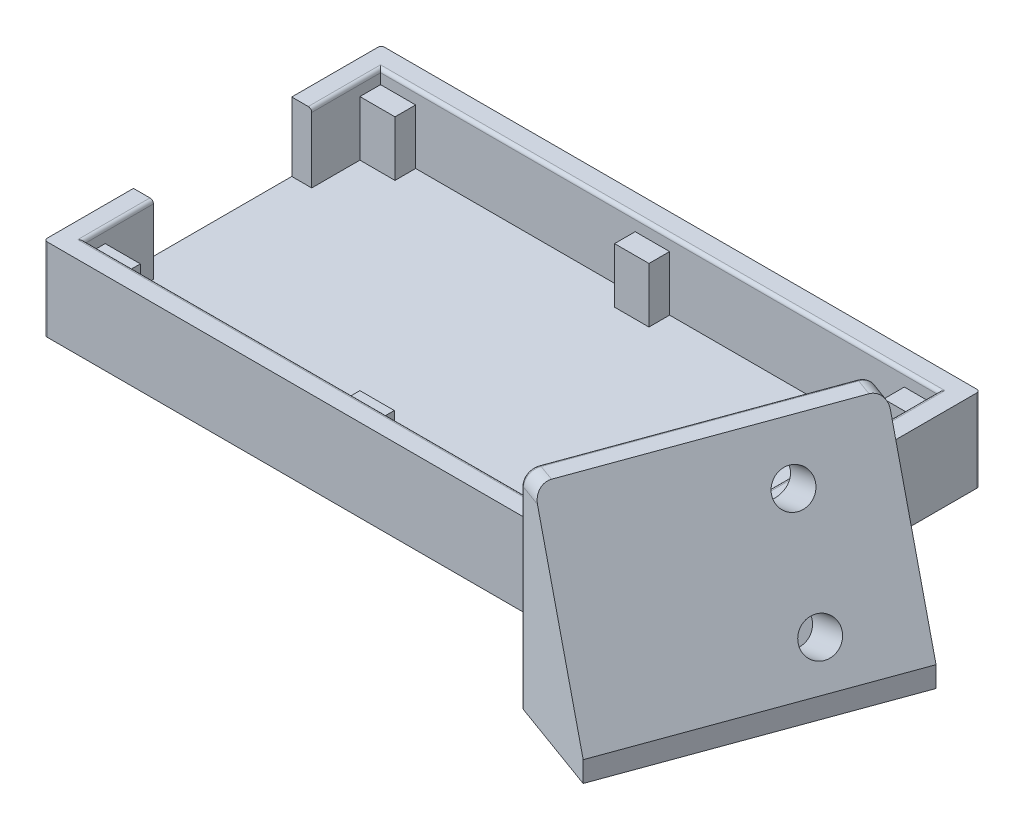
from build123d import *

# Parameters (mm, degrees)
BOSS_EXTRUDE1_DEPTH   = 40
BODY_MOVE_COPY1_ANGLE = 20
BOSS_EXTRUDE2_DEPTH   = 2
BOSS_EXTRUDE3_DEPTH   = 12
SKETCH4_R             = 2.5
CUT_EXTRUDE2_DEPTH    = 8
FILLET1_R             = 2
SKETCH10_W            = 4.9
SKETCH10_H            = 3
SKETCH10_W_2          = 5.1
SKETCH10_W_3          = 5
CUT_EXTRUDE4_DEPTH    = 2
FILLET2_R             = 0.5


with BuildPart() as part:
    # Sketch2 → Boss-Extrude1 (new body)
    with BuildSketch(Plane.XY):
        Polygon((90, 0), (105, 0), (105, 3), (93, 30), (90, 30), align=None)
    extrude(amount=BOSS_EXTRUDE1_DEPTH)


with BuildPart() as part_1:
    # Body-Move/Copy1: moved
    add(part.part.rotate(Axis((95, 0, 20), (0, -1, 0)), BODY_MOVE_COPY1_ANGLE))


with BuildPart() as part_2:
    # Body-Move/Copy2: moved
    add(part_1.part.moved(Location((-2, 0, -25))))

    # Sketch1 → Boss-Extrude2 (add)
    with BuildSketch(Plane(origin=(0, 0, 0), x_dir=(1, 0, 0), z_dir=(0, 1, 0))):
        Polygon((0, 49), (0, 0), (77, 0), (89.02081528, -12.02081528), (99.02081528, -2.02081528), (87, 10), (87, 49), align=None)
    extrude(amount=BOSS_EXTRUDE2_DEPTH)

    # Sketch1<4> → Boss-Extrude3 (add)
    with BuildSketch(Plane(origin=(0, 0, 0), x_dir=(1, 0, 0), z_dir=(0, 1, 0))):
        Polygon((8, 43), (8, 46), (39.9, 46), (39.9, 43), (44.9, 43), (44.9, 46), (79, 46), (79, 43), (83.9, 43), (83.9, 6), (79, 6), (79, 3), (44.9, 3), (44.9, 6), (39.9, 6), (39.9, 3), (8, 3), (8, 6), (2.9, 6), (2.9, 13), (0, 13), (0, 0), (77, 0), (87, 0), (87, 10), (87, 49), (0, 49), (0, 36), (2.9, 36), (2.9, 43), align=None)
    extrude(amount=BOSS_EXTRUDE3_DEPTH)

    # Sketch4 → Cut-Extrude2 (cut)
    with BuildSketch(Plane(origin=(76.126595154, 36.005435759, 27.707814672), x_dir=(0.29946549765090347, 0.09724282163216282, -0.9491386881576961), z_dir=(0.8587019690275818, 0.40613846605344794, 0.3125419568312492))):
        with Locations((42.744832372, -18.834040509)):
            Circle(SKETCH4_R)
        with Locations((41.048584848, -34.683530859)):
            Circle(SKETCH4_R)
    extrude(amount=-CUT_EXTRUDE2_DEPTH, mode=Mode.SUBTRACT)

    # Fillet1
    fillet1_edges = [part_2.edges().sort_by_distance(p)[0] for p in [
        (96.551478694, 30, -24.990922917),
        (82.870672961, 30, 12.596781914),
    ]]
    fillet(fillet1_edges, radius=FILLET1_R)

    # Sketch10 → Cut-Extrude4 (cut)
    with BuildSketch(Plane(origin=(0, 12, 0), x_dir=(1, 0, 0), z_dir=(0, 1, 0))):
        with Locations((81.45, 4.5)):
            Rectangle(SKETCH10_W, SKETCH10_H)
        with Locations((42.45, 4.5)):
            Rectangle(SKETCH10_W_2, SKETCH10_H)
        with Locations((42.4, 44.5)):
            Rectangle(SKETCH10_W_3, SKETCH10_H)
        with Locations((81.45, 44.5)):
            Rectangle(SKETCH10_W, SKETCH10_H)
        with Locations((5.45, 44.5)):
            Rectangle(SKETCH10_W_2, SKETCH10_H)
        with Locations((5.45, 4.5)):
            Rectangle(SKETCH10_W_2, SKETCH10_H)
    extrude(amount=-CUT_EXTRUDE4_DEPTH, mode=Mode.SUBTRACT)

    # Fillet2
    fillet2_edges = [part_2.edges().sort_by_distance(p)[0] for p in [
        (2.9, 12, -8),
        (2.9, 12, -41),
        (0, 6, 0),
        (87, 6, -49),
        (0, 6, -49),
        (94.941589001, 29.414213562, -24.95349394),
        (88.301536896, 30, -6.710100717),
        (81.661484791, 29.414213562, 11.533292506),
        (95.141939763, 14, -25.503953132),
        (81.46113403, 14, 12.083751699),
        (43.4, 12, -3),
        (83.9, 12, -24.5),
        (43.4, 12, -46),
    ]]
    fillet(fillet2_edges, radius=FILLET2_R)


solid = part_2.part
